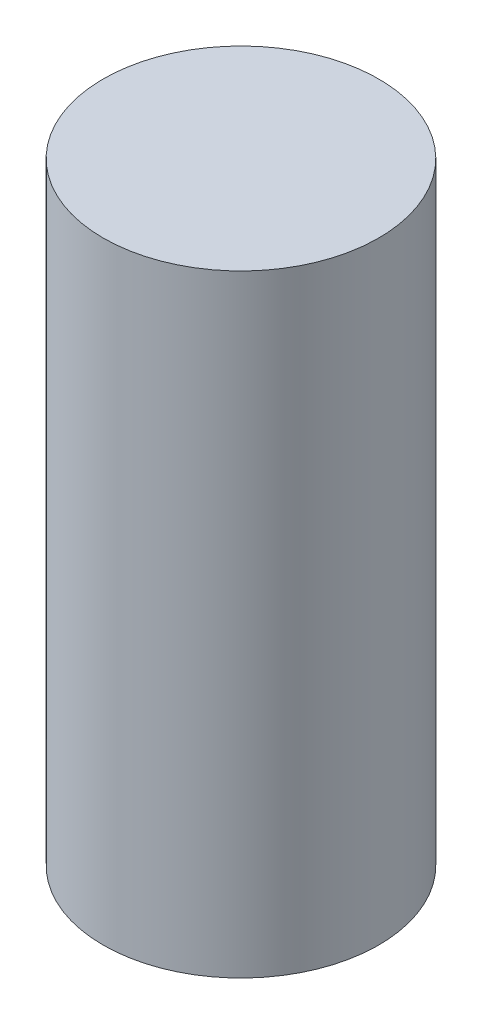
from build123d import *

# Parameters (mm, degrees)
SKETCH1_R           = 4.95
BOSS_EXTRUDE1_DEPTH = 22


with BuildPart() as part:
    # Sketch1 → Boss-Extrude1 (new body)
    with BuildSketch(Plane(origin=(0, 0, 0), x_dir=(1, 0, 0), z_dir=(0, 1, 0))):
        with Locations(Location((0, 0, 0), (0, 0, 270))):
            Circle(SKETCH1_R)
    extrude(amount=BOSS_EXTRUDE1_DEPTH)


solid = part.part
